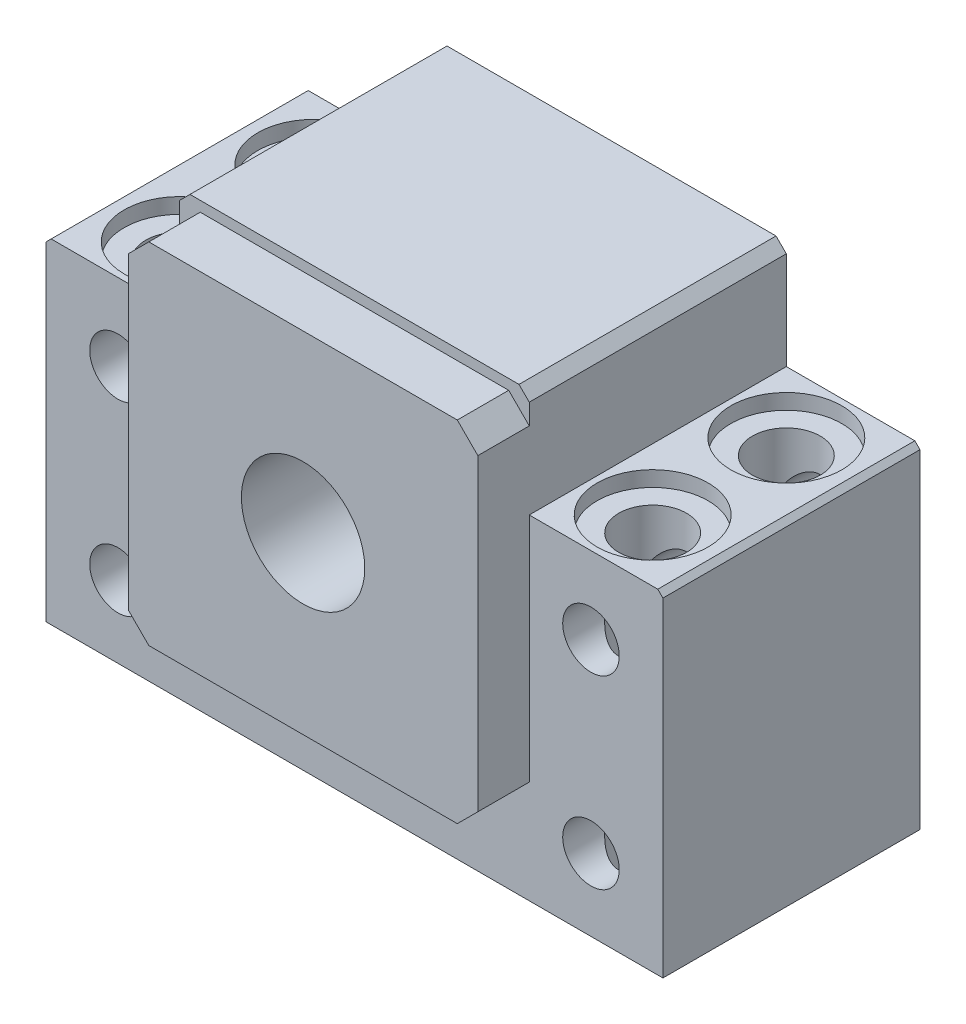
from build123d import *

# Parameters (mm, degrees)
SKETCH_1_R          = 6
SKETCH_1_R_2        = 2.75
EXTRUDE_1_DEPTH     = 25
EXTRUDE_START       = 5
SKETCH_2_R          = 6
EXTRUDE_2_DEPTH     = 5
CUT_EXTRUDE_START   = 7.5
SKETCH_3_R          = 3.3
CUT_EXTRUDE_1_DEPTH = 54.868092477
SKETCH_4_R          = 5.4
CUT_EXTRUDE_2_DEPTH = 1.5


with BuildPart() as part:
    # Эскиз1 → Бобышка-Вытянуть1 (new body)
    with BuildSketch(Plane.XY):
        Polygon((-30, 7), (-30, -25), (30, -25), (30, 7), (29.5, 7.5), (17, 7.5), (17, 17), (16, 18), (-16, 18), (-17, 17), (-17, 7.5), (-29.5, 7.5), align=None)
        Circle(SKETCH_1_R, mode=Mode.SUBTRACT)
        with Locations((-23, 0)):
            Circle(SKETCH_1_R_2, mode=Mode.SUBTRACT)
        with Locations((-23, -18)):
            Circle(SKETCH_1_R_2, mode=Mode.SUBTRACT)
        with Locations(Location((23, -18, 0), (0, 0, 180))):
            Circle(SKETCH_1_R_2, mode=Mode.SUBTRACT)
        with Locations(Location((23, 0, 0), (0, 0, 180))):
            Circle(SKETCH_1_R_2, mode=Mode.SUBTRACT)
    extrude(amount=-EXTRUDE_1_DEPTH)

    # Эскиз2 → Бобышка-Вытянуть2 (add)
    with BuildSketch(Plane.XY.offset(EXTRUDE_START)):
        Polygon((-17, 15), (-15, 17), (15, 17), (17, 15), (17, -15), (15, -17), (-15, -17), (-17, -15), align=None)
        Circle(SKETCH_2_R, mode=Mode.SUBTRACT)
    extrude(amount=-EXTRUDE_2_DEPTH)

    # Эскиз3 → Вырез-Вытянуть1 (cut, through all)
    with BuildSketch(Plane(origin=(0, 0, 0), x_dir=(1, 0, 0), z_dir=(0, 1, 0)).offset(CUT_EXTRUDE_START)):
        with Locations(Location((-23, 19, 0), (0, 0, 270))):
            Circle(SKETCH_3_R)
        with Locations(Location((-23, 6, 0), (0, 0, 270))):
            Circle(SKETCH_3_R)
        with Locations(Location((23, 6, 0), (0, 0, 270))):
            Circle(SKETCH_3_R)
        with Locations(Location((23, 19, 0), (0, 0, 270))):
            Circle(SKETCH_3_R)
    extrude(amount=-CUT_EXTRUDE_1_DEPTH, mode=Mode.SUBTRACT)

    # Эскиз4 → Вырез-Вытянуть2 (cut)
    with BuildSketch(Plane(origin=(0, 0, 0), x_dir=(1, 0, 0), z_dir=(0, 1, 0)).offset(CUT_EXTRUDE_START)):
        with Locations(Location((-23, 19, 0), (0, 0, 270))):
            Circle(SKETCH_4_R)
        with Locations(Location((-23, 6, 0), (0, 0, 270))):
            Circle(SKETCH_4_R)
        with Locations(Location((23, 6, 0), (0, 0, 270))):
            Circle(SKETCH_4_R)
        with Locations(Location((23, 19, 0), (0, 0, 270))):
            Circle(SKETCH_4_R)
    extrude(amount=-CUT_EXTRUDE_2_DEPTH, mode=Mode.SUBTRACT)


solid = part.part
